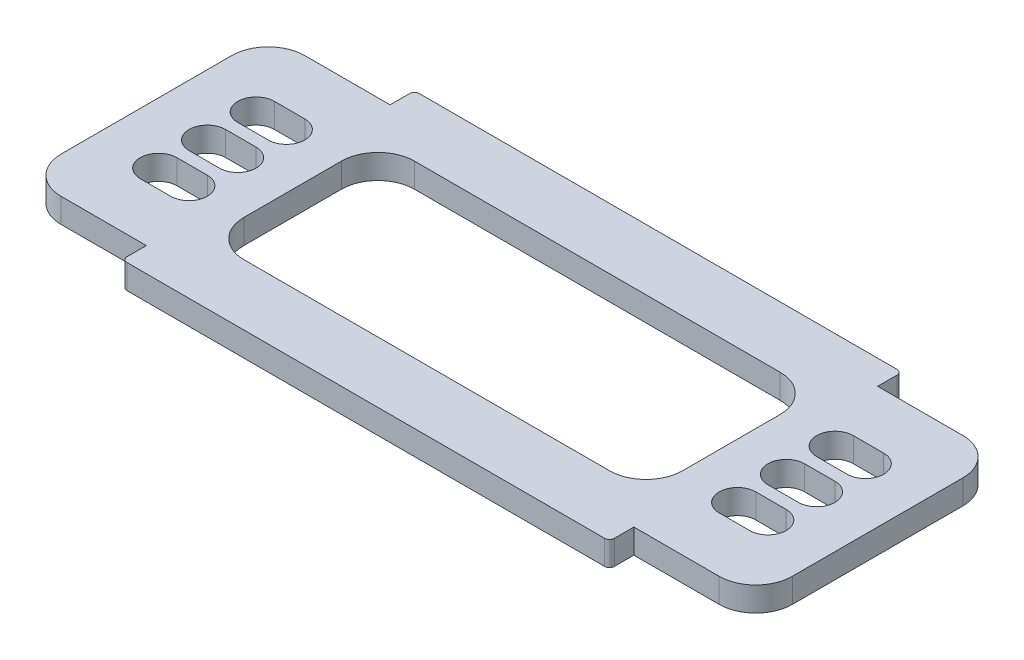
from build123d import *

# Parameters (mm, degrees)
SKETCH_1_W          = 40
SKETCH_1_H          = 24
EXTRUDE_1_DEPTH     = 2
SKETCH_4_W          = 60
SKETCH_4_H          = 20
EXTRUDE_3_DEPTH     = 2
CUT_EXTRUDE_3_DEPTH = 33.372828112
SKETCH_7_W          = 36
SKETCH_7_H          = 14
CUT_EXTRUDE_4_DEPTH = 33.372828112
FILLET_1_R          = 3
FILLET_2_R          = 0.4


with BuildPart() as part:
    # 草图1 → 凸台-拉伸1 (new body)
    with BuildSketch(Plane(origin=(0, 0, 0), x_dir=(1, 0, 0), z_dir=(0, 1, 0))):
        Rectangle(SKETCH_1_W, SKETCH_1_H)
    extrude(amount=EXTRUDE_1_DEPTH)

    # 草图4 → 凸台-拉伸3 (add)
    with BuildSketch(Plane(origin=(0, 2, 0), x_dir=(1, 0, 0), z_dir=(0, 1, 0))):
        Rectangle(SKETCH_4_W, SKETCH_4_H)
    extrude(amount=-EXTRUDE_3_DEPTH)

    # 草图6 → 切除-拉伸3 (cut, through all)
    with BuildSketch(Plane(origin=(0, 2, 0), x_dir=(1, 0, 0), z_dir=(0, 1, 0))):
        with BuildLine():
            Line((-25, 1.5), (-22.5, 1.5))
            ThreePointArc((-22.5, 1.5), (-21, 0), (-22.5, -1.5))
            Line((-22.5, -1.5), (-25, -1.5))
            ThreePointArc((-25, -1.5), (-26.5, 0), (-25, 1.5))
        make_face()
        with BuildLine():
            Line((-25, 5.5), (-22.5, 5.5))
            ThreePointArc((-22.5, 5.5), (-21, 4), (-22.5, 2.5))
            Line((-22.5, 2.5), (-25, 2.5))
            ThreePointArc((-25, 2.5), (-26.5, 4), (-25, 5.5))
        make_face()
        with BuildLine():
            Line((-25, -2.5), (-22.5, -2.5))
            ThreePointArc((-22.5, -2.5), (-21, -4), (-22.5, -5.5))
            Line((-22.5, -5.5), (-25, -5.5))
            ThreePointArc((-25, -5.5), (-26.5, -4), (-25, -2.5))
        make_face()
        with BuildLine():
            Line((25, -2.5), (22.5, -2.5))
            ThreePointArc((22.5, -2.5), (21, -4), (22.5, -5.5))
            Line((22.5, -5.5), (25, -5.5))
            ThreePointArc((25, -5.5), (26.5, -4), (25, -2.5))
        make_face()
        with BuildLine():
            Line((25, 1.5), (22.5, 1.5))
            ThreePointArc((22.5, 1.5), (21, 0), (22.5, -1.5))
            Line((22.5, -1.5), (25, -1.5))
            ThreePointArc((25, -1.5), (26.5, 0), (25, 1.5))
        make_face()
        with BuildLine():
            Line((25, 5.5), (22.5, 5.5))
            ThreePointArc((22.5, 5.5), (21, 4), (22.5, 2.5))
            Line((22.5, 2.5), (25, 2.5))
            ThreePointArc((25, 2.5), (26.5, 4), (25, 5.5))
        make_face()
    extrude(amount=-CUT_EXTRUDE_3_DEPTH, mode=Mode.SUBTRACT)

    # 草图7 → 切除-拉伸4 (cut, through all)
    with BuildSketch(Plane(origin=(0, 2, 0), x_dir=(1, 0, 0), z_dir=(0, 1, 0))):
        Rectangle(SKETCH_7_W, SKETCH_7_H)
    extrude(amount=-CUT_EXTRUDE_4_DEPTH, mode=Mode.SUBTRACT)

    # 圆角1
    fillet_1_edges = [part.edges().sort_by_distance(p)[0] for p in [
        (18, 1, -7),
        (18, 1, 7),
        (-18, 1, 7),
        (-18, 1, -7),
        (30, 1, 10),
        (-30, 1, -10),
        (30, 1, -10),
        (-30, 1, 10),
    ]]
    fillet(fillet_1_edges, radius=FILLET_1_R)

    # 圆角2
    fillet_2_edges = [part.edges().sort_by_distance(p)[0] for p in [
        (20, 1, 12),
        (-20, 1, 12),
        (-20, 1, -12),
        (20, 1, -12),
    ]]
    fillet(fillet_2_edges, radius=FILLET_2_R)


solid = part.part
